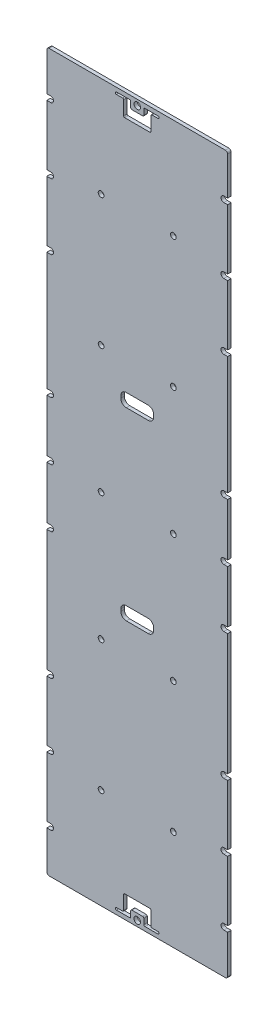
from build123d import *

# Parameters (mm, degrees)
SKETCH1_W            = 82.8
SKETCH1_H            = 327.3
PCB_EXTRUDE_DEPTH    = 1.6
SKETCH2_W            = 82.8
SKETCH2_H            = 327.3
SKETCH2_W_2          = 82.5
SKETCH2_H_2          = 327
OFFSET_EDGES_DEPTH   = 10
CORNER_FILLETS_R     = 1
SKETCH3_R            = 1.5
SKETCH3_W            = 15
SKETCH3_H            = 6
SOLAR_HOLE_DEPTH     = 169.630876473
SOLAR_HOLE_FILLET_R  = 0.5
M2_CLEARANCE_HOLE1_D = 2.6
SKETCH9_W            = 1.75
SKETCH9_H            = 2.6
CUT_EXTRUDE1_DEPTH   = 169.630876473
FILLET1_R            = 2.5


with BuildPart() as part:
    # Sketch1 → PCB extrude (new body)
    with BuildSketch(Plane.XY):
        Rectangle(SKETCH1_W, SKETCH1_H)
    extrude(amount=PCB_EXTRUDE_DEPTH)

    # Sketch2 → offset edges (cut)
    with BuildSketch(Plane.XY):
        Rectangle(SKETCH2_W, SKETCH2_H)
        Rectangle(SKETCH2_W_2, SKETCH2_H_2, mode=Mode.SUBTRACT)
    extrude(amount=OFFSET_EDGES_DEPTH, mode=Mode.SUBTRACT)

    # corner fillets
    corner_fillets_edges = [part.edges().sort_by_distance(p)[0] for p in [
        (41.25, 163.5, 0.8),
        (-41.25, 163.5, 0.8),
        (-41.25, -163.5, 0.8),
        (41.25, -163.5, 0.8),
    ]]
    fillet(corner_fillets_edges, radius=CORNER_FILLETS_R)

    # Sketch3 → Solar hole (cut, symmetric)
    with BuildSketch(Plane.XY):
        with Locations((0, 160.95)):
            Circle(SKETCH3_R)
        with BuildLine():
            Line((-2.999999999, 158.15), (2.999999999, 158.15))
            Line((2.999999999, 158.15), (2.999999999, 161.65))
            Line((2.999999999, 161.65), (9.5, 161.65))
            ThreePointArc((9.5, 161.65), (10, 161.15), (9.5, 160.65))
            Line((9.5, 160.65), (6.2, 160.65))
            Line((6.2, 160.65), (6.2, 153.35))
            Line((6.2, 153.35), (-6.2, 153.35))
            Line((-6.2, 153.35), (-6.2, 160.65))
            Line((-6.2, 160.65), (-9.5, 160.65))
            ThreePointArc((-9.5, 160.65), (-10, 161.15), (-9.5, 161.65))
            Line((-9.5, 161.65), (-2.999999999, 161.65))
            Line((-2.999999999, 161.65), (-2.999999999, 158.15))
        make_face()
        with Locations((0, 42.125)):
            Rectangle(SKETCH3_W, SKETCH3_H)
    solar_hole = extrude(amount=SOLAR_HOLE_DEPTH, both=True, mode=Mode.SUBTRACT)

    # Solar hole mirror: Solar hole across plane
    add(solar_hole.mirror(Plane.ZX), mode=Mode.SUBTRACT)

    # Solar Hole Fillet
    solar_hole_fillet_edges = [part.edges().sort_by_distance(p)[0] for p in [
        (2.999999999, 161.65, 0.8),
        (2.999999999, 158.15, 0.8),
        (-2.999999999, 158.15, 0.8),
        (-2.999999999, 161.65, 0.8),
        (-6.2, 160.65, 0.8),
        (-6.2, 153.35, 0.8),
        (6.2, 153.35, 0.8),
        (6.2, 160.65, 0.8),
        (6.2, -160.65, 0.8),
        (6.2, -153.35, 0.8),
        (-6.2, -153.35, 0.8),
        (-6.2, -160.65, 0.8),
        (-2.999999999, -161.65, 0.8),
        (-2.999999999, -158.15, 0.8),
        (2.999999999, -158.15, 0.8),
        (2.999999999, -161.65, 0.8),
    ]]
    fillet(solar_hole_fillet_edges, radius=SOLAR_HOLE_FILLET_R)

    # M2 Clearance Hole1 (through all)
    with Locations(Plane.XY.offset(1.6)):
        with Locations((-39.5, 143.75), (-39.5, 113.75), (-39.5, 83.75), (-39.5, 27.25), (-39.5, 0.75), (-39.5, -25.75), (-39.5, -83.75), (-39.5, -113.75), (-39.5, -143.75), (-16.5, -117.75), (16.5, -117.75), (39.5, -143.75), (39.5, -113.75), (39.5, -83.75), (16.5, -58.1), (-16.5, -58.1), (39.5, -25.75), (39.5, 0.75), (16.5, 0), (-16.5, 0), (39.5, 27.25), (16.5, 58.1), (-16.5, 58.1), (16.5, 117.75), (-16.5, 117.75), (39.5, 83.75), (39.5, 113.75), (39.5, 143.75)):
            Hole(M2_CLEARANCE_HOLE1_D / 2)

    # Sketch9 → Cut-Extrude1 (cut, through all)
    with BuildSketch(Plane.XY):
        with Locations((-40.375, 143.75)):
            Rectangle(SKETCH9_W, SKETCH9_H)
        with Locations((40.375, 143.75)):
            Rectangle(SKETCH9_W, SKETCH9_H)
        with Locations((40.375, 113.75)):
            Rectangle(SKETCH9_W, SKETCH9_H)
        with Locations((40.375, 83.75)):
            Rectangle(SKETCH9_W, SKETCH9_H)
        with Locations((-40.375, 113.75)):
            Rectangle(SKETCH9_W, SKETCH9_H)
        with Locations((-40.375, 83.75)):
            Rectangle(SKETCH9_W, SKETCH9_H)
        with Locations((40.375, 27.25)):
            Rectangle(SKETCH9_W, SKETCH9_H)
        with Locations((-40.375, 27.25)):
            Rectangle(SKETCH9_W, SKETCH9_H)
        with Locations((40.375, 0.75)):
            Rectangle(SKETCH9_W, SKETCH9_H)
        with Locations((-40.375, 0.75)):
            Rectangle(SKETCH9_W, SKETCH9_H)
        with Locations((40.375, -25.75)):
            Rectangle(SKETCH9_W, SKETCH9_H)
        with Locations((-40.375, -25.75)):
            Rectangle(SKETCH9_W, SKETCH9_H)
        with Locations((40.375, -83.75)):
            Rectangle(SKETCH9_W, SKETCH9_H)
        with Locations((-40.375, -83.75)):
            Rectangle(SKETCH9_W, SKETCH9_H)
        with Locations((40.375, -113.75)):
            Rectangle(SKETCH9_W, SKETCH9_H)
        with Locations((-40.375, -113.75)):
            Rectangle(SKETCH9_W, SKETCH9_H)
        with Locations((40.375, -143.75)):
            Rectangle(SKETCH9_W, SKETCH9_H)
        with Locations((-40.375, -143.75)):
            Rectangle(SKETCH9_W, SKETCH9_H)
    extrude(amount=CUT_EXTRUDE1_DEPTH, mode=Mode.SUBTRACT)

    # Fillet1
    fillet1_edges = [part.edges().sort_by_distance(p)[0] for p in [
        (-7.5, -39.125, 0.8),
        (-7.5, -45.125, 0.8),
        (7.5, -45.125, 0.8),
        (7.5, -39.125, 0.8),
        (-7.5, 45.125, 0.8),
        (-7.5, 39.125, 0.8),
        (7.5, 39.125, 0.8),
        (7.5, 45.125, 0.8),
    ]]
    fillet(fillet1_edges, radius=FILLET1_R)


solid = part.part
